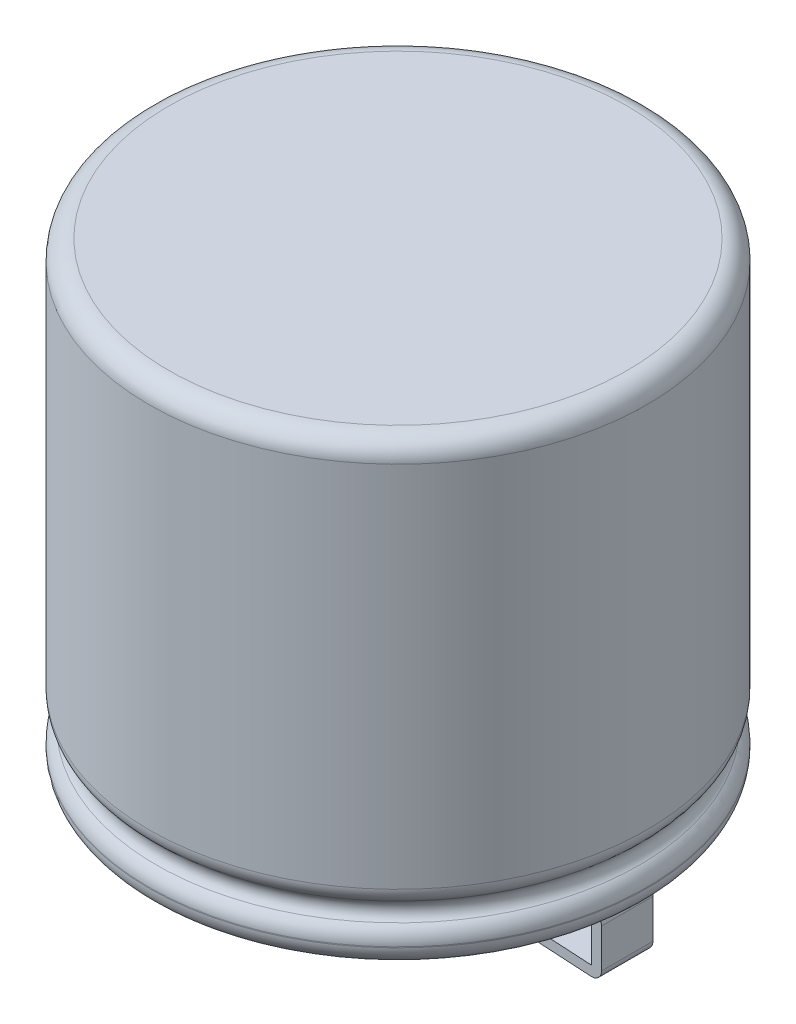
from build123d import *

# Parameters (mm, degrees)
TAB_DEPTH          = 0.325
TAB_2_DEPTH        = 0.325
CUT_EXTRUDE1_DEPTH = 8.313344055


with BuildPart() as part:
    # Sketch1 → Cap Body (revolve)
    with BuildSketch(Plane(origin=(0, 0, 0), x_dir=(0, 0, -1), z_dir=(1, 0, 0))):
        with BuildLine():
            Line((0, 2.9), (0, -2.9))
            Line((0, -2.9), (2.9, -2.9))
            ThreePointArc((2.9, -2.9), (3.076776695, -2.826776695), (3.15, -2.65))
            Line((3.15, -2.65), (3.15, -2.638280347))
            ThreePointArc((3.15, -2.638280347), (3.125108719, -2.529532636), (3.055391484, -2.442439884))
            ThreePointArc((3.055391484, -2.442439884), (2.997790055, -2.32320442), (3.055391484, -2.203968956))
            ThreePointArc((3.055391484, -2.203968956), (3.125108719, -2.116876204), (3.15, -2.008128493))
            Line((3.15, -2.008128493), (3.15, 2.65))
            ThreePointArc((3.15, 2.65), (3.076776695, 2.826776695), (2.9, 2.9))
            Line((2.9, 2.9), (0, 2.9))
        make_face()
    revolve(axis=Axis((0, -4.584100675, 0), (0, 1, 0)))


with BuildPart() as body_2:
    # Tab Sketch → Tab (new, symmetric)
    with BuildSketch(Plane.XY):
        with BuildLine():
            Line((-0.7875, -2.9), (-2.775, -2.9))
            ThreePointArc((-2.775, -2.9), (-2.863388348, -2.936611652), (-2.9, -3.025))
            Line((-2.9, -3.025), (-2.9, -3.51739175))
            ThreePointArc((-2.9, -3.51739175), (-2.860740484, -3.608350914), (-2.767622888, -3.642173873))
            Line((-2.767622888, -3.642173873), (-0.783811444, -3.524891062))
            ThreePointArc((-0.783811444, -3.524891062), (-0.725108938, -3.458811444), (-0.791188556, -3.400108938))
            Line((-0.791188556, -3.400108938), (-2.775, -3.51739175))
            Line((-2.775, -3.51739175), (-2.775, -3.025))
            Line((-2.775, -3.025), (-0.7875, -3.025))
            ThreePointArc((-0.7875, -3.025), (-0.725, -2.9625), (-0.7875, -2.9))
        make_face()
    extrude(amount=TAB_DEPTH, both=True)


with BuildPart() as body_3:
    # Tab Sketch → Tab 2 (new, symmetric)
    with BuildSketch(Plane.XY):
        with BuildLine():
            Line((0.7875, -2.9), (2.775, -2.9))
            ThreePointArc((2.775, -2.9), (2.863388348, -2.936611652), (2.9, -3.025))
            Line((2.9, -3.025), (2.9, -3.51739175))
            ThreePointArc((2.9, -3.51739175), (2.860740484, -3.608350914), (2.767622888, -3.642173873))
            Line((2.767622888, -3.642173873), (0.783811444, -3.524891062))
            ThreePointArc((0.783811444, -3.524891062), (0.725108938, -3.458811444), (0.791188556, -3.400108938))
            Line((0.791188556, -3.400108938), (2.775, -3.51739175))
            Line((2.775, -3.51739175), (2.775, -3.025))
            Line((2.775, -3.025), (0.7875, -3.025))
            ThreePointArc((0.7875, -3.025), (0.725, -2.9625), (0.7875, -2.9))
        make_face()
    extrude(amount=TAB_2_DEPTH, both=True)


with BuildPart() as cut_extrude1_tool:
    # Sketch4 → Cut-Extrude1 (new, through all)
    with BuildSketch(Plane.XZ.offset(2.9)):
        with BuildLine():
            Line((-1.05, 0.325), (-0.725, 0.325))
            Line((-0.725, 0.325), (0.725, 0.325))
            Line((0.725, 0.325), (1.05, 0.325))
            ThreePointArc((1.05, 0.325), (0.725, 0), (1.05, -0.325))
            Line((1.05, -0.325), (0.725, -0.325))
            Line((0.725, -0.325), (-0.725, -0.325))
            Line((-0.725, -0.325), (-1.05, -0.325))
            ThreePointArc((-1.05, -0.325), (-0.725, 0), (-1.05, 0.325))
        make_face()
    extrude(amount=CUT_EXTRUDE1_DEPTH)


with BuildPart() as body_2_1:
    add(body_2.part)

    # Cut-Extrude1: cut by cut_extrude1_tool
    add(cut_extrude1_tool.part, mode=Mode.SUBTRACT)


with BuildPart() as body_3_1:
    add(body_3.part)

    # Cut-Extrude1: cut by cut_extrude1_tool
    add(cut_extrude1_tool.part, mode=Mode.SUBTRACT)


solid = Compound([part.part, body_2_1.part, body_3_1.part])
